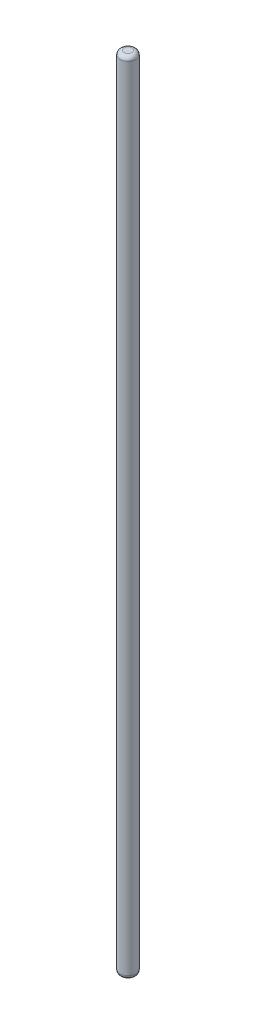
from build123d import *

# Parameters (mm, degrees)
SKETCH1_R           = 3
BOSS_EXTRUDE1_DEPTH = 300
FILLET1_R           = 1.5


with BuildPart() as part:
    # Sketch1 → Boss-Extrude1 (new body)
    with BuildSketch(Plane(origin=(0, 0, 0), x_dir=(1, 0, 0), z_dir=(0, 1, 0))):
        with Locations(Location((0, 0, 0), (0, 0, 270))):
            Circle(SKETCH1_R)
    extrude(amount=BOSS_EXTRUDE1_DEPTH)

    # Fillet1
    fillet1_edges = [part.edges().sort_by_distance(p)[0] for p in [
        (0, 0, -3),
        (0, 300, -3),
    ]]
    fillet(fillet1_edges, radius=FILLET1_R)


solid = part.part
